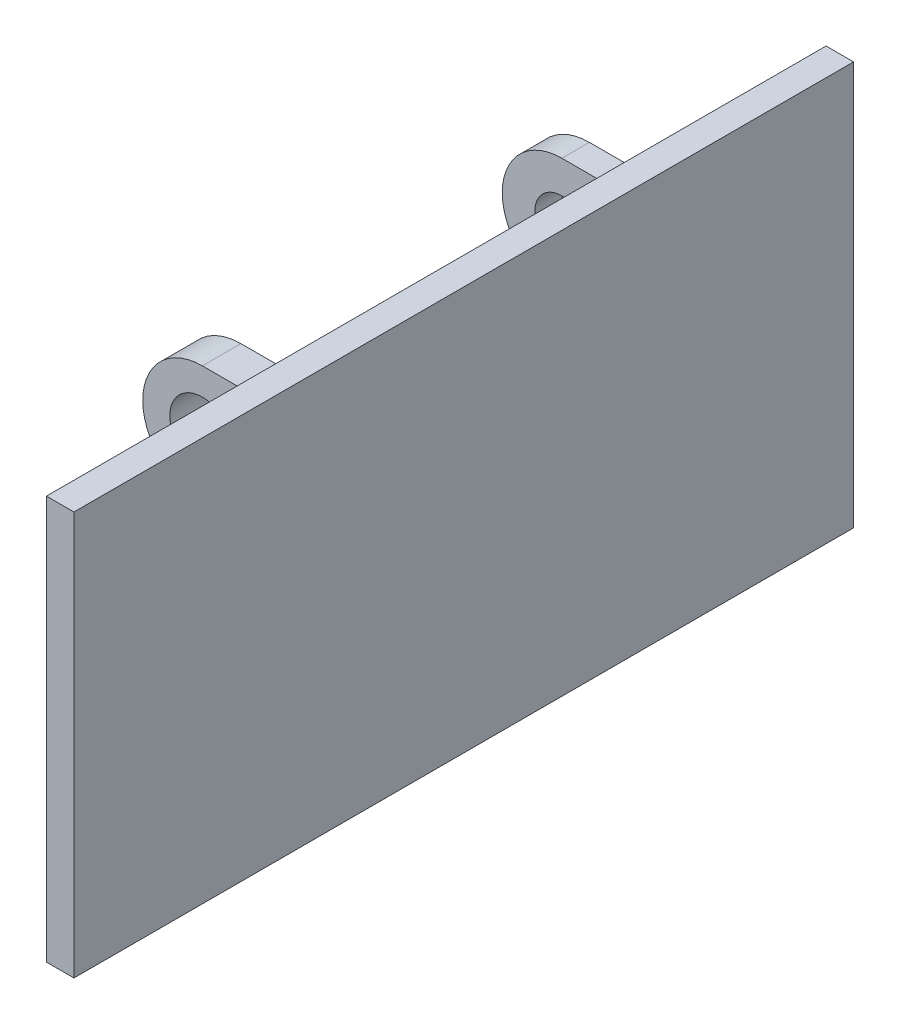
from build123d import *

# Parameters (mm, degrees)
BOSS_EXTRUDE1_START = 123.5
SKETCH1_W           = 85
SKETCH1_H           = 44
BOSS_EXTRUDE1_DEPTH = 1.5
BOSS_EXTRUDE2_START = 14.1
SKETCH2_R           = 6.5
BOSS_EXTRUDE2_DEPTH = 2.1
BOSS_EXTRUDE3_START = 14.1
SKETCH3_W           = 14.3
SKETCH3_H           = 13
BOSS_EXTRUDE3_DEPTH = 2.1
CUT_EXTRUDE1_START  = 14.1
SKETCH4_R           = 3.55
CUT_EXTRUDE1_DEPTH  = 2.1
CUT_EXTRUDE2_START  = 14.1
CUT_EXTRUDE2_DEPTH  = 2.1
BOSS_EXTRUDE4_START = -24.5
SKETCH6_R           = 6.5
BOSS_EXTRUDE4_DEPTH = 1.5
BOSS_EXTRUDE5_START = -24.5
SKETCH7_W           = 14.3
SKETCH7_H           = 13
BOSS_EXTRUDE5_DEPTH = 1.5
CUT_EXTRUDE3_START  = -24.5
SKETCH8_R           = 2.95
CUT_EXTRUDE3_DEPTH  = 1.5


with BuildPart() as part:
    # Sketch1 → Boss-Extrude1 (new, symmetric)
    with BuildSketch(Plane(origin=(0, 0, 0), x_dir=(0, 0, -1), z_dir=(1, 0, 0)).offset(BOSS_EXTRUDE1_START)):
        with Locations((-4.5, -24)):
            Rectangle(SKETCH1_W, SKETCH1_H)
    extrude(amount=BOSS_EXTRUDE1_DEPTH, both=True)



with BuildPart() as body_2:
    # Sketch2 → Boss-Extrude2 (new, symmetric)
    with BuildSketch(Plane.XY.offset(BOSS_EXTRUDE2_START)):
        with Locations((108.2, -18.5)):
            Circle(SKETCH2_R)
    extrude(amount=BOSS_EXTRUDE2_DEPTH, both=True)


with BuildPart() as part_1:
    add(part.part)

    add(body_2.part)  # Boss-Extrude3 merges body 2
    # Sketch3 → Boss-Extrude3 (add, symmetric)
    with BuildSketch(Plane.XY.offset(BOSS_EXTRUDE3_START)):
        with Locations((115.35, -18.5)):
            Rectangle(SKETCH3_W, SKETCH3_H)
    extrude(amount=BOSS_EXTRUDE3_DEPTH, both=True)

    # Sketch4 → Cut-Extrude1 (cut, symmetric)
    with BuildSketch(Plane.XY.offset(CUT_EXTRUDE1_START)):
        with Locations((108.2, -18.5)):
            Circle(SKETCH4_R)
    extrude(amount=CUT_EXTRUDE1_DEPTH, both=True, mode=Mode.SUBTRACT)

    # Sketch5 → Cut-Extrude2 (cut, symmetric)
    with BuildSketch(Plane.XY.offset(CUT_EXTRUDE2_START)):
        Polygon((108.2, -14.95), (120.9, -16.096718595), (120.9, -20.903281405), (108.2, -22.05), align=None)
    extrude(amount=CUT_EXTRUDE2_DEPTH, both=True, mode=Mode.SUBTRACT)



with BuildPart() as body_2_2:
    # Sketch6 → Boss-Extrude4 (new, symmetric)
    with BuildSketch(Plane.XY.offset(BOSS_EXTRUDE4_START)):
        with Locations(Location((108.2, -18.5, 0), (0, 0, 180))):
            Circle(SKETCH6_R)
    extrude(amount=BOSS_EXTRUDE4_DEPTH, both=True)


with BuildPart() as part_2:
    add(part_1.part)

    add(body_2_2.part)  # Boss-Extrude5 merges body 2 2
    # Sketch7 → Boss-Extrude5 (add, symmetric)
    with BuildSketch(Plane.XY.offset(BOSS_EXTRUDE5_START)):
        with Locations((115.35, -18.5)):
            Rectangle(SKETCH7_W, SKETCH7_H)
    extrude(amount=BOSS_EXTRUDE5_DEPTH, both=True)

    # Sketch8 → Cut-Extrude3 (cut, symmetric)
    with BuildSketch(Plane.XY.offset(CUT_EXTRUDE3_START)):
        with Locations((108.2, -18.5)):
            Circle(SKETCH8_R)
    extrude(amount=CUT_EXTRUDE3_DEPTH, both=True, mode=Mode.SUBTRACT)


solid = part_2.part
